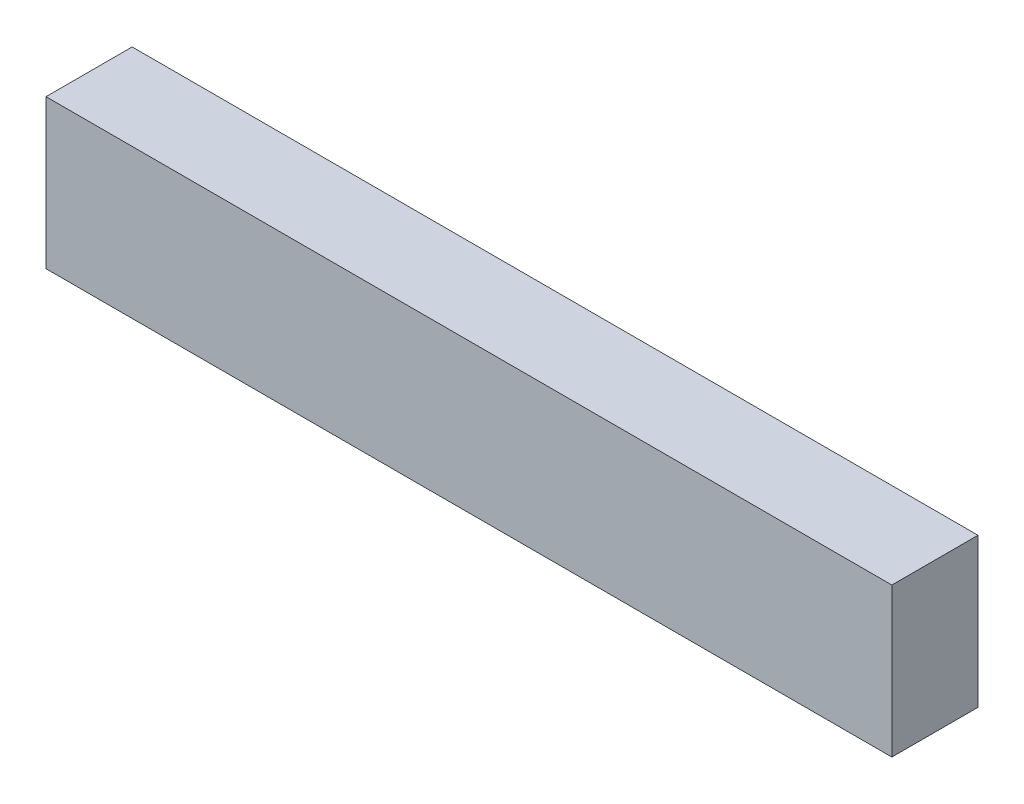
from build123d import *

# Parameters (mm, degrees)
SKETCH1_W                 = 71.18130149
SKETCH1_H                 = 12.54
BOSS_EXTRUDE1_DEPTH       = 7.25
SHELL1_T                  = -0.5
SHELL1_THICKNESS_2_FACE_W = 70.18130149
SHELL1_THICKNESS_2_FACE_H = 11.54
SHELL1_THICKNESS_2_DEPTH  = 0.3


with BuildPart() as part:
    # Sketch1 → Boss-Extrude1 (new body)
    with BuildSketch(Plane.XY):
        with Locations((-43.446150745, -7.96)):
            Rectangle(SKETCH1_W, SKETCH1_H)
    extrude(amount=BOSS_EXTRUDE1_DEPTH)

    # Shell1
    shell1_openings = [part.faces().sort_by_distance(p)[0] for p in [
        (-43.446150745, -7.96, 0),
    ]]
    offset(amount=SHELL1_T, openings=shell1_openings, kind=Kind.INTERSECTION)

    # Shell1 thickness 2 face (on inner face of the shell) → Shell1 thickness 2 (cut)
    with BuildSketch(Plane(origin=(-43.446150745, -7.96, 6.75), x_dir=(1, 0, 0), z_dir=(0, 0, 1))):
        Rectangle(SHELL1_THICKNESS_2_FACE_W, SHELL1_THICKNESS_2_FACE_H)
    extrude(amount=SHELL1_THICKNESS_2_DEPTH, mode=Mode.SUBTRACT)


solid = part.part
